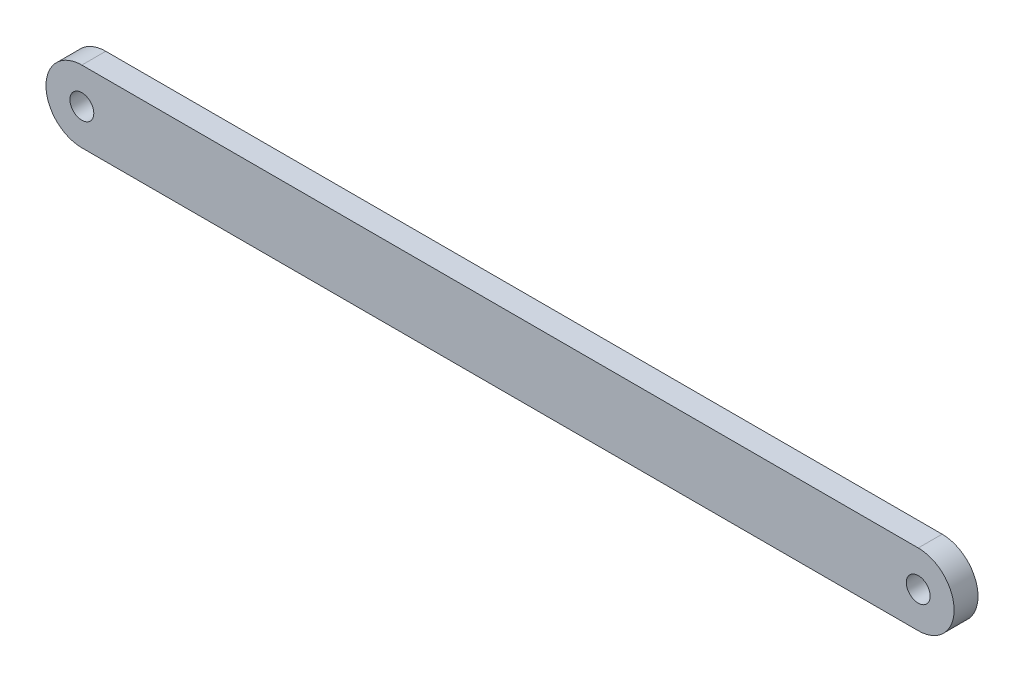
from build123d import *

# Parameters (mm, degrees)
IZIM1_R                     = 5
Y_KSEKLIK_EKSTR_ZYON1_DEPTH = 5


with BuildPart() as part:
    # Çizim1 → Yükseklik-Ekstrüzyon1 (new, symmetric)
    with BuildSketch(Plane.XY):
        with BuildLine():
            Line((-175, 15), (175, 15))
            ThreePointArc((175, 15), (190, 0), (175, -15))
            Line((175, -15), (-175, -15))
            ThreePointArc((-175, -15), (-190, 0), (-175, 15))
        make_face()
        with Locations((175, 0)):
            Circle(IZIM1_R, mode=Mode.SUBTRACT)
        with Locations((-175, 0)):
            Circle(IZIM1_R, mode=Mode.SUBTRACT)
    extrude(amount=Y_KSEKLIK_EKSTR_ZYON1_DEPTH, both=True)


solid = part.part
